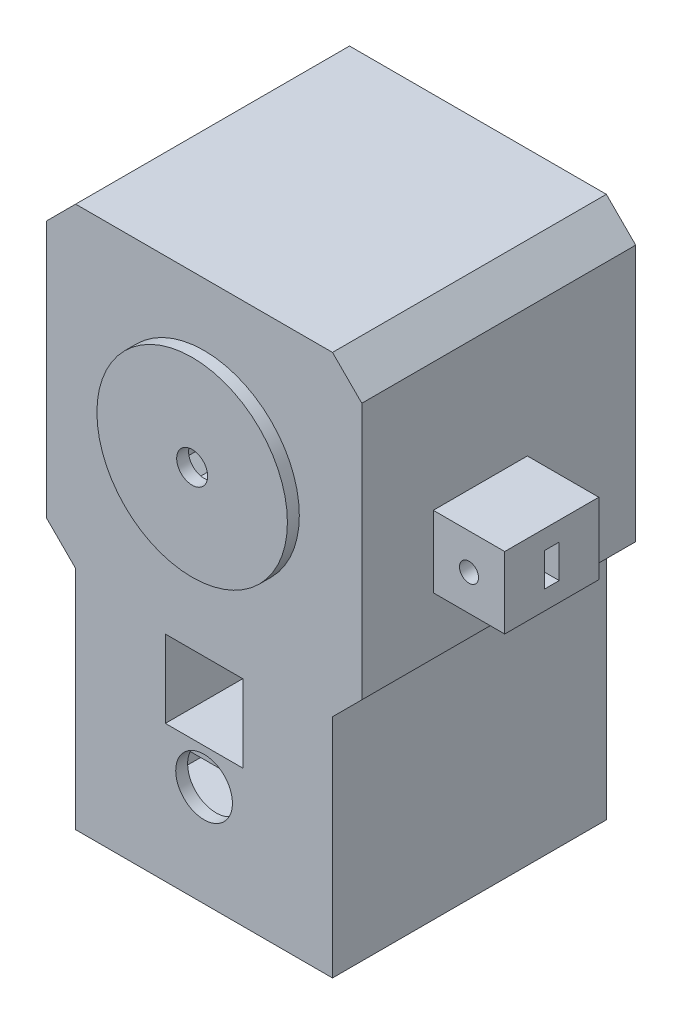
from build123d import *

# Parameters (mm, degrees)
SALIENTE_EXTRUIR1_DEPTH      = 22
CROQUIS2_W                   = 43.142135624
CROQUIS2_H                   = 44
SALIENTE_EXTRUIR2_DEPTH      = 8
CROQUIS3_W                   = 33.76116098
CROQUIS3_H                   = 8
CORTAR_EXTRUIR1_DEPTH        = 49.74935897
CROQUIS4_R                   = 11
SALIENTE_EXTRUIR4_DEPTH      = 2
CROQUIS7_R                   = 16
CROQUIS7_R_2                 = 2.6
SALIENTE_EXTRUIR5_DEPTH      = 2
CROQUIS6_W                   = 28
CROQUIS6_H                   = 12
CORTAR_EXTRUIR3_DEPTH        = 13
SALIENTE_EXTRUIR6_DEPTH      = 12
SALIENTE_EXTRUIR6_DEPTH_BACK = 3.8
CROQUIS8_W                   = 12
CROQUIS8_H                   = 12
CROQUIS8_R                   = 1.6
CROQUIS9_W                   = 2.5
CROQUIS9_H                   = 5.6
CORTAR_EXTRUIR4_DEPTH        = 10
CROQUIS11_W                  = 43.142135624
CROQUIS11_H                  = 46
SALIENTE_EXTRUIR8_DEPTH      = 30
CROQUIS12_W                  = 37.142135624
CROQUIS12_H                  = 28
CORTAR_EXTRUIR5_DEPTH        = 44
CROQUIS14_W                  = 13
CROQUIS14_H                  = 13
CORTAR_EXTRUIR7_DEPTH        = 25
CROQUIS13_R                  = 4.7625
CORTAR_EXTRUIR6_DEPTH        = 2
SALIENTE_EXTRUIR9_DEPTH      = 25
CROQUIS16_W                  = 13
CROQUIS16_H                  = 13
SALIENTE_EXTRUIR11_DEPTH     = 3.2


with BuildPart() as part:
    # Croquis1 → Saliente-Extruir1 (new, symmetric)
    with BuildSketch(Plane.XY):
        Polygon((26.5, -21.571067812), (26.5, 21.571067812), (21.571067812, 26.5), (-21.571067812, 26.5), (-26.5, 21.571067812), (-26.5, -21.571067812), (-21.571067812, -26.5), (21.571067812, -26.5), align=None)
        Polygon((-19.5, -21.5), (-21.5, -19.5), (-21.5, 19.5), (-19.5, 21.5), (19.5, 21.5), (21.5, 19.5), (21.5, -19.5), (19.5, -21.5), align=None, mode=Mode.SUBTRACT)
    extrude(amount=SALIENTE_EXTRUIR1_DEPTH, both=True)

    # Croquis2 → Saliente-Extruir2 (add)
    with BuildSketch(Plane.XZ.offset(26.5)):
        Rectangle(CROQUIS2_W, CROQUIS2_H)
    extrude(amount=SALIENTE_EXTRUIR2_DEPTH)

    # Croquis3 → Cortar-Extruir1 (cut, through all)
    with BuildSketch(Plane.XY):
        with Locations((0, -25.5)):
            Rectangle(CROQUIS3_W, CROQUIS3_H)
    extrude(amount=-CORTAR_EXTRUIR1_DEPTH, mode=Mode.SUBTRACT)

    # Croquis4 → Saliente-Extruir4 (add)
    with BuildSketch(Plane(origin=(0, 0, 22), x_dir=(-1, 0, 0), z_dir=(0, 0, -1))):
        Polygon((-26.5, -21.571067812), (-21.571067812, -26.5), (-21.571067812, -34.5), (21.571067812, -34.5), (21.571067812, -26.5), (26.5, -21.571067812), (26.5, 21.571067812), (21.571067812, 26.5), (-21.571067812, 26.5), (-26.5, 21.571067812), align=None)
        Circle(CROQUIS4_R, mode=Mode.SUBTRACT)
    extrude(amount=-SALIENTE_EXTRUIR4_DEPTH)

    # Croquis7 → Saliente-Extruir5 (add)
    with BuildSketch(Plane.XY.offset(24)):
        with Locations(Location((0, 0, 0), (0, 0, 180))):
            Circle(CROQUIS7_R)
        Circle(CROQUIS7_R_2, mode=Mode.SUBTRACT)
    extrude(amount=SALIENTE_EXTRUIR5_DEPTH)

    # Croquis6 → Cortar-Extruir3 (cut)
    with BuildSketch(Plane(origin=(0, -29.5, 0), x_dir=(1, 0, 0), z_dir=(0, 1, 0))):
        with Locations((0, 12)):
            Rectangle(CROQUIS6_W, CROQUIS6_H)
    extrude(amount=-CORTAR_EXTRUIR3_DEPTH, mode=Mode.SUBTRACT)

    # Croquis8 → Saliente-Extruir6 (add, two sides: drawn at the far end of the back side and taken through both)
    # profile 1 of 2: a face of its own
    with BuildSketch(Plane.XY.offset(-SALIENTE_EXTRUIR6_DEPTH_BACK)):
        with Locations((-32.5, -6)):
            Rectangle(CROQUIS8_W, CROQUIS8_H)
        with Locations((-32.5, -6)):
            Circle(CROQUIS8_R, mode=Mode.SUBTRACT)
    # profile 2 of 2: a face of its own
    with BuildSketch(Plane.XY.offset(-SALIENTE_EXTRUIR6_DEPTH_BACK)):
        with Locations((32.5, -6)):
            Rectangle(CROQUIS8_W, CROQUIS8_H)
        with Locations((32.5, -6)):
            Circle(CROQUIS8_R, mode=Mode.SUBTRACT)
    extrude(amount=SALIENTE_EXTRUIR6_DEPTH + SALIENTE_EXTRUIR6_DEPTH_BACK)

    # Croquis9 → Cortar-Extruir4 (cut)
    with BuildSketch(Plane(origin=(38.5, 0, 0), x_dir=(0, 0, -1), z_dir=(1, 0, 0))):
        with Locations((-4.1, -6)):
            Rectangle(CROQUIS9_W, CROQUIS9_H)
    cortar_extruir4 = extrude(amount=-CORTAR_EXTRUIR4_DEPTH, mode=Mode.SUBTRACT)

    # Simetría1: Cortar-Extruir4 across plane
    add(cortar_extruir4.mirror(Plane(origin=(0, 0, 0), x_dir=(0, 0, 1), z_dir=(1, 0, 0))), mode=Mode.SUBTRACT)

    # Croquis11 → Saliente-Extruir8 (add)
    with BuildSketch(Plane.XZ.offset(34.5)):
        with Locations((0, 1)):
            Rectangle(CROQUIS11_W, CROQUIS11_H)
    extrude(amount=SALIENTE_EXTRUIR8_DEPTH)

    # Croquis12 → Cortar-Extruir5 (cut)
    with BuildSketch(Plane(origin=(0, 0, -22), x_dir=(-1, 0, 0), z_dir=(0, 0, -1))):
        with Locations((0, -47.5)):
            Rectangle(CROQUIS12_W, CROQUIS12_H)
    extrude(amount=-CORTAR_EXTRUIR5_DEPTH, mode=Mode.SUBTRACT)

    # Croquis14 → Cortar-Extruir7 (cut)
    with BuildSketch(Plane.XY.offset(24)):
        with Locations((0, -35)):
            Rectangle(CROQUIS14_W, CROQUIS14_H)
    extrude(amount=-CORTAR_EXTRUIR7_DEPTH, mode=Mode.SUBTRACT)

    # Croquis13 → Cortar-Extruir6 (cut)
    with BuildSketch(Plane(origin=(0, 0, 22), x_dir=(-1, 0, 0), z_dir=(0, 0, -1))):
        with Locations((0, -47.5)):
            Circle(CROQUIS13_R)
    extrude(amount=-CORTAR_EXTRUIR6_DEPTH, mode=Mode.SUBTRACT)

    # Croquis15 → Saliente-Extruir9 (add)
    with BuildSketch(Plane(origin=(0, 0, 22), x_dir=(-1, 0, 0), z_dir=(0, 0, -1))):
        Polygon((-6.5, -33.5), (-18.571067812, -33.5), (-6.571067812, -45.5), (6.571067812, -45.5), (18.571067812, -33.5), (6.5, -33.5), (6.5, -41.5), (-6.5, -41.5), align=None)
    extrude(amount=SALIENTE_EXTRUIR9_DEPTH)

    # Croquis16 → Saliente-Extruir11 (add)
    with BuildSketch(Plane(origin=(0, 0, -3), x_dir=(-1, 0, 0), z_dir=(0, 0, -1))):
        with Locations((0, -35)):
            Rectangle(CROQUIS16_W, CROQUIS16_H)
    extrude(amount=-SALIENTE_EXTRUIR11_DEPTH)


solid = part.part
